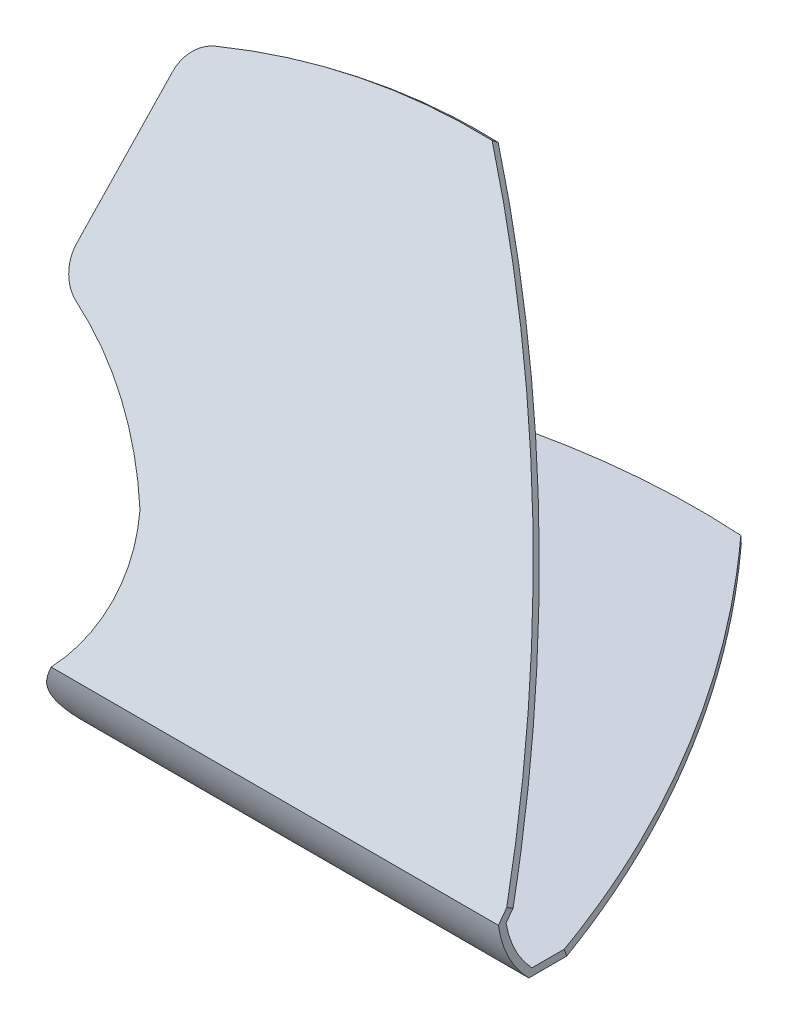
from build123d import *

# Parameters (mm, degrees)
BOSS_EXTRUDE5_REACH            = 265.679
BOSS_EXTRUDE6_REACH            = 265.679
BOSS_EXTRUDE6_END_MAJOR_RADIUS = 41.29497886
BOSS_EXTRUDE6_END_MINOR_RADIUS = 34.238910582
CUT_EXTRUDE2_DEPTH             = 264.679090264
CUT_EXTRUDE2_DEPTH_BACK        = 264.679090264
SKETCH15_W                     = 51.852711212
SKETCH15_H                     = 208.671256167
CUT_EXTRUDE3_DEPTH             = 268.405797009
CUT_EXTRUDE3_TAPER             = -7
FILLET1_R                      = 10


with BuildPart() as part:
    # Sweep1: sweep along a path in Sketch9
    with BuildLine(Plane(origin=(0, 0, 0), x_dir=(0, 0, -1), z_dir=(1, 0, 0))) as sweep1_path:
        ThreePointArc((6.690833444, 0), (4.4769871, 9.372874687), (-1.696623298, 16.764655947))
    # Sketch3 → Sweep1 (sweep)
    with BuildSketch(Plane(origin=(0, 0, 0), x_dir=(1, 0, 0), z_dir=(0, 1, 0))):
        with BuildLine():
            Line((142.439103739, 11.914830112), (143.614236161, 6.690833444))
            Line((143.614236161, 6.690833444), (83.614236161, 6.690833444))
            Line((83.614236161, 6.690833444), (68.614236161, 6.690833444))
            ThreePointArc((68.614236161, 6.690833444), (75.180479735, 23.997298156), (71.779240838, 42.192375773))
            ThreePointArc((71.779240838, 42.192375773), (51.379079295, 63.12072091), (24.905577059, 75.502800726))
            ThreePointArc((24.905577059, 75.502800726), (11.315687886, 83.748123559), (5.247844857, 98.440016471))
            ThreePointArc((5.247844857, 98.440016471), (7.693142423, 109.618807389), (15.866887418, 117.62722417))
            ThreePointArc((15.866887418, 117.62722417), (96.637810578, 139.573762678), (179.070811064, 125.068832083))
            ThreePointArc((179.070811064, 125.068832083), (185.95529686, 120.311391566), (190.290589438, 113.153555076))
            Line((190.290589438, 113.153555076), (190.62158299, 112.199107439))
            ThreePointArc((190.62158299, 112.199107439), (191.44765289, 108.968802746), (191.725584387, 105.646151098))
            Line((191.725584387, 105.646151098), (191.725584387, 88.676044486))
            ThreePointArc((191.725584387, 88.676044486), (190.474138078, 74.473395816), (185.740302271, 61.024524277))
            ThreePointArc((185.740302271, 61.024524277), (167.286232208, 33.651220513), (142.439103739, 11.914830112))
        make_face()
    sweep(path=sweep1_path.line)

    # Boss-Extrude5: up to this cone (the profile starts outside it)
    boss_extrude5_end = Plane(origin=(191.725584, 0, 14.257299609), z_dir=(-1, 0, 0)).offset(43.399088878) * Cone(4.445e-06, 990.357764429, 222.779911122, align=(Align.CENTER, Align.CENTER, Align.MIN), mode=Mode.PRIVATE)
    # Sketch11 → Boss-Extrude5 (add, up to the surface)
    with BuildSketch(Plane(origin=(191.725584387, 0, 0), x_dir=(0, 0, -1), z_dir=(1, 0, 0)), mode=Mode.PRIVATE) as boss_extrude5_sk1:
        with BuildLine():
            Line((47.462397011, 82.376892243), (30.882313527, 60.247558735))
            Line((30.882313527, 60.247558735), (1.435728928, 20.945386831))
            ThreePointArc((1.435728928, 20.945386831), (9.148899919, 11.710260363), (11.914830112, 0))
            Line((11.914830112, 0), (61.024524277, 0))
            Line((61.024524277, 0), (88.676044486, 0))
            ThreePointArc((88.676044486, 0), (77.797814579, 46.055719281), (47.462397011, 82.376892243))
        make_face()
    boss_extrude5_tool1 = extrude(boss_extrude5_sk1.sketch, amount=-BOSS_EXTRUDE5_REACH, mode=Mode.PRIVATE) - boss_extrude5_end
    add(boss_extrude5_tool1.solids().sort_by_distance((191.725584, 31.140819, -47.986254))[0])

    # Boss-Extrude6: up to this torus (the profile starts outside it)
    boss_extrude6_end = Plane(origin=(41.076827722, 0, 14.257299609), z_dir=(1, 0, 0)) * Torus(BOSS_EXTRUDE6_END_MAJOR_RADIUS, BOSS_EXTRUDE6_END_MINOR_RADIUS, mode=Mode.PRIVATE)
    # Sketch12 → Boss-Extrude6 (add, up to the surface)
    with BuildSketch(Plane(origin=(191.725584387, 0, 0), x_dir=(0, 0, -1), z_dir=(1, 0, 0)), mode=Mode.PRIVATE) as boss_extrude6_sk1:
        with BuildLine():
            Line((1.435728928, 20.945386831), (-1.696623298, 16.764655947))
            ThreePointArc((-1.696623298, 16.764655947), (1.119891209, 7.693299714), (6.690833444, 0))
            Line((6.690833444, 0), (11.914830112, 0))
            ThreePointArc((11.914830112, 0), (9.148899919, 11.710260363), (1.435728928, 20.945386831))
        make_face()
    boss_extrude6_tool1 = extrude(boss_extrude6_sk1.sketch, amount=-BOSS_EXTRUDE6_REACH, mode=Mode.PRIVATE) - boss_extrude6_end
    add(boss_extrude6_tool1.solids().sort_by_distance((191.725584, 9.709782, -5.15039))[0])

    # Sketch14 → Cut-Extrude2 (cut, two sides: drawn at the far end of the back side and taken through both)
    with BuildSketch(Plane(origin=(191.725584387, 0, 0), x_dir=(0, 0, -1), z_dir=(1, 0, 0)).offset(-CUT_EXTRUDE2_DEPTH_BACK)):
        with BuildLine():
            Line((105.646151098, 2), (149.683498086, 2))
            Line((149.683498086, 2), (149.683498086, 144.664441597))
            Line((149.683498086, 144.664441597), (96.629526617, 144.664441597))
            Line((96.629526617, 144.664441597), (46.505246197, 77.763878679))
            Line((46.505246197, 77.763878679), (0.408030952, 16.238214412))
            ThreePointArc((0.408030952, 16.238214412), (2.90852666, 8.588164632), (7.531494019, 2))
            Line((7.531494019, 2), (84.410363787, 2))
            Line((84.410363787, 2), (88.676044486, 2))
            Line((88.676044486, 2), (105.646151098, 2))
        make_face()
    extrude(amount=CUT_EXTRUDE2_DEPTH + CUT_EXTRUDE2_DEPTH_BACK, mode=Mode.SUBTRACT)

    # Sketch15 → Cut-Extrude3 (cut, through all)
    with BuildSketch(Plane(origin=(0, 0, 0), x_dir=(1, 0, 0), z_dir=(0, -0.10182146993355343, 0.9948026881048173))):
        with Locations((-1.277666278, 17.910609482)):
            Rectangle(SKETCH15_W, SKETCH15_H)
    extrude(amount=-CUT_EXTRUDE3_DEPTH, taper=CUT_EXTRUDE3_TAPER, mode=Mode.SUBTRACT)

    # Fillet1
    fillet1_edges = [part.edges().sort_by_distance(p)[0] for p in [
        (40.347072898, 1.000004161, -128.41868422),
        (34.696815444, 111.874269162, -70.812250863),
        (30.333338635, 69.924766029, -39.382594446),
        (33.541632629, 1.000078518, -72.703242973),
    ]]
    fillet(fillet1_edges, radius=FILLET1_R)

    # Cut-Sweep1: sweep along a path in Sketch17
    with BuildLine(Plane(origin=(0, 0, 0), x_dir=(0, 0, -1), z_dir=(1, 0, 0))) as cut_sweep1_path:
        ThreePointArc((62.370921608, 102.275206583), (105.746248809, 53.324211599), (121.268282878, -10.210703039))
    # Sketch16 → Cut-Sweep1 (sweep, cut)
    with BuildSketch(Plane(origin=(0, 6.841546732, 9.131369543), x_dir=(1, 0, 0), z_dir=(0, 0.599608388931302, 0.8002935585916011))):
        with BuildLine():
            Line((95.683594782, 159.687794473), (195.090767436, 159.687794473))
            Line((195.090767436, 159.687794473), (195.090767436, 6.80339077))
            ThreePointArc((195.090767436, 6.80339077), (154.850931705, 89.399030557), (95.683594782, 159.687794473))
        make_face()
    sweep(path=cut_sweep1_path.line, mode=Mode.SUBTRACT)


solid = part.part
